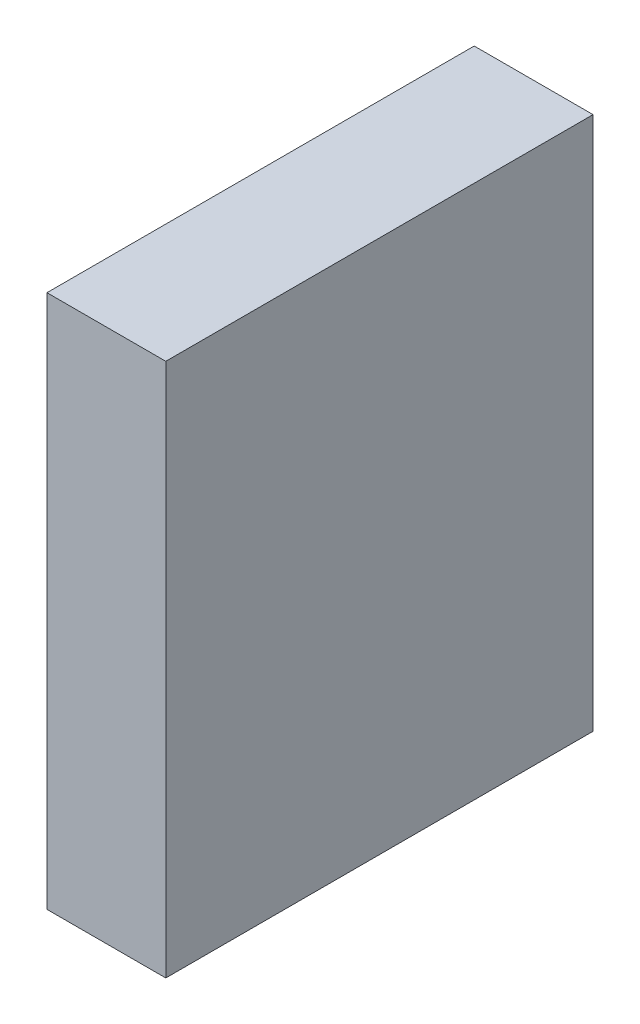
from build123d import *

# Parameters (mm, degrees)
SKETCH1_W           = 80
SKETCH1_H           = 100
BOSS_EXTRUDE1_DEPTH = 22.25


with BuildPart() as part:
    # Sketch1 → Boss-Extrude1 (new body)
    with BuildSketch(Plane(origin=(0, 0, 0), x_dir=(0, 0, -1), z_dir=(1, 0, 0))):
        with Locations((-11.920831682, -8.294767718)):
            Rectangle(SKETCH1_W, SKETCH1_H)
    extrude(amount=-BOSS_EXTRUDE1_DEPTH)


solid = part.part
